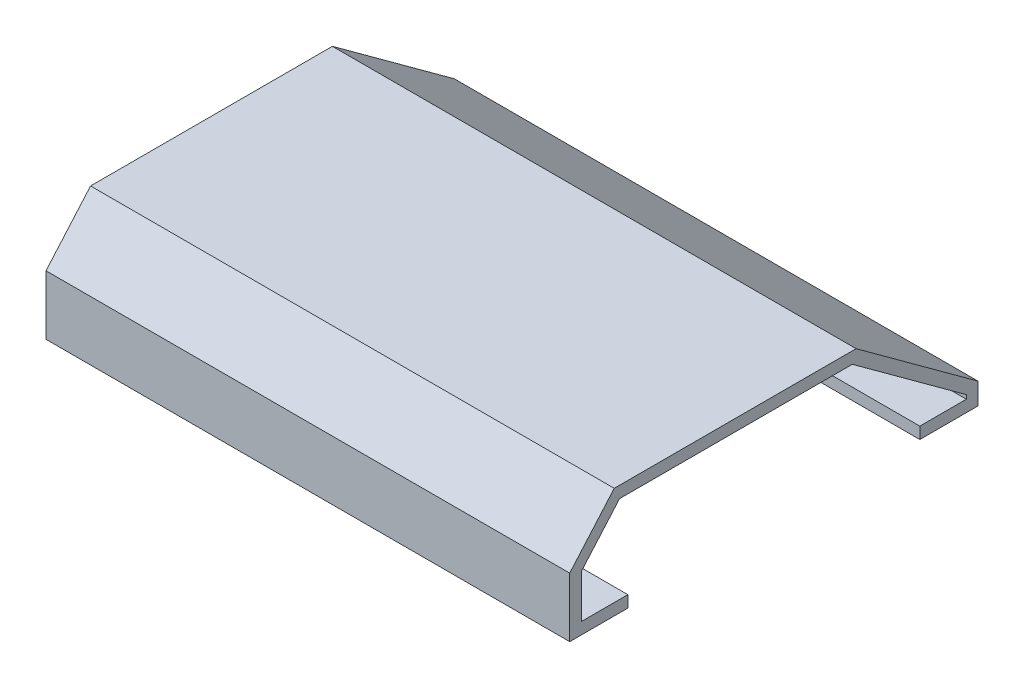
from build123d import *

# Parameters (mm, degrees)
BOSS_EXTRUDE1_DEPTH = 90


with BuildPart() as part:
    # Sketch1 → Boss-Extrude1 (new body)
    with BuildSketch(Plane(origin=(0, 0, 0), x_dir=(0, 0, -1), z_dir=(1, 0, 0))):
        Polygon((-26.219478533, 0), (-34.219478533, 0), (-34.219478533, 7.455891804), (-27.655452975, 15), (12.344547025, 15), (31.950180828, 0.680147815), (31.950180828, 0), (23.950180828, 0), (23.950180828, -2), (33.950180828, -2), (33.950180828, 1.696030664), (12.997169955, 17), (-28.566355722, 17), (-36.219478533, 8.204180117), (-36.219478533, -2), (-26.219478533, -2), align=None)
    extrude(amount=BOSS_EXTRUDE1_DEPTH)


solid = part.part
